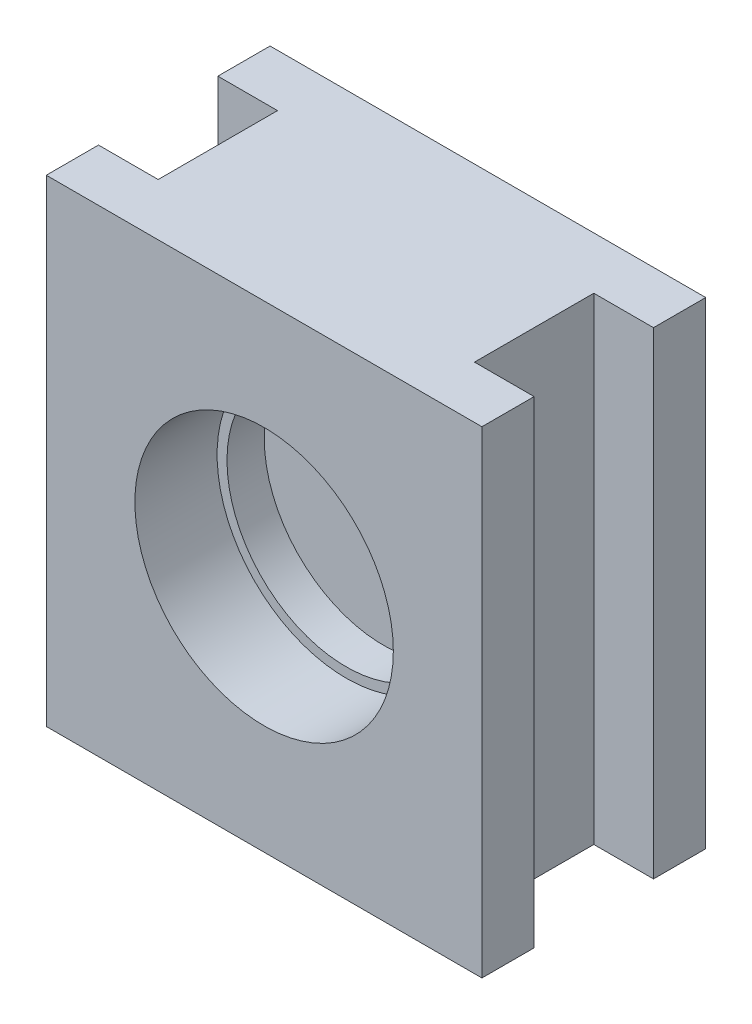
from build123d import *

# Parameters (mm, degrees)
SKETCH1_W           = 26.924
SKETCH1_H           = 40.64
BOSS_EXTRUDE1_DEPTH = 19.05
SKETCH2_W           = 4.445
SKETCH2_H           = 40.64
BOSS_EXTRUDE2_DEPTH = 5.08
SKETCH3_R           = 11
CUT_EXTRUDE1_DEPTH  = 7
SKETCH4_R           = 10.16
CUT_EXTRUDE2_DEPTH  = 3.175


with BuildPart() as part:
    # Sketch1 → Boss-Extrude1 (new body)
    with BuildSketch(Plane.XY):
        Rectangle(SKETCH1_W, SKETCH1_H)
    extrude(amount=BOSS_EXTRUDE1_DEPTH)

    # Sketch2 → Boss-Extrude2 (add)
    with BuildSketch(Plane(origin=(13.462, 0, 0), x_dir=(0, 0, -1), z_dir=(1, 0, 0))):
        with Locations((-16.8275, 0)):
            Rectangle(SKETCH2_W, SKETCH2_H)
        with Locations((-2.2225, 0)):
            Rectangle(SKETCH2_W, SKETCH2_H)
    boss_extrude2 = extrude(amount=BOSS_EXTRUDE2_DEPTH)

    # Mirror1: Boss-Extrude2 across plane
    add(boss_extrude2.mirror(Plane(origin=(0, 0, 0), x_dir=(0, 0, 1), z_dir=(1, 0, 0))))

    # Sketch3 → Cut-Extrude1 (cut)
    with BuildSketch(Plane.XY.offset(19.05)):
        Circle(SKETCH3_R)
    extrude(amount=-CUT_EXTRUDE1_DEPTH, mode=Mode.SUBTRACT)

    # Sketch4 → Cut-Extrude2 (cut)
    with BuildSketch(Plane.XY.offset(12.05)):
        Circle(SKETCH4_R)
    extrude(amount=-CUT_EXTRUDE2_DEPTH, mode=Mode.SUBTRACT)


solid = part.part
